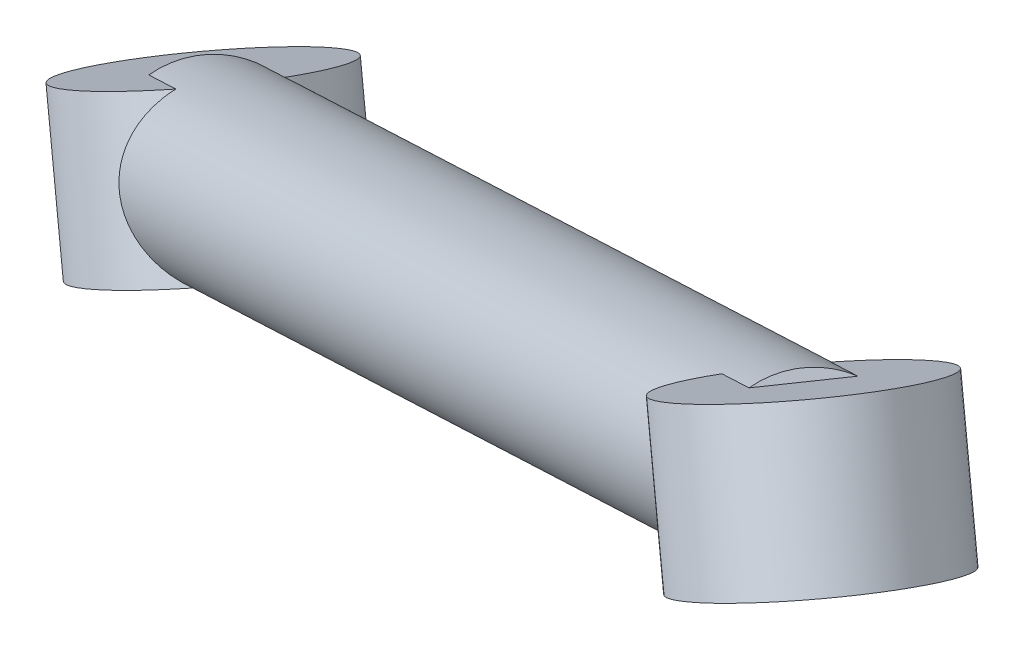
from build123d import *

# Parameters (mm, degrees)
SUSP_FL_PULLROD_PROFILE_R                = 8
SUSP_FL_PULLROD_ROD_END_MOUNT_PROFILE_R  = 11
SUSP_FL_PULLROD_ROD_END_ROCKER_PROFILE_R = 11


with BuildPart() as part:
    # SUSP_FL_pullrod: sweep along a curve in space
    with BuildLine() as susp_fl_pullrod_path:
        Line((-510.46, -91.34, -282.35), (-343.0563, 19.7951, -174.0819))
    # SUSP_FL_pullrod profile (on start of the path) → SUSP_FL_pullrod (sweep)
    with BuildSketch(Plane(origin=(-510.46, -91.34, -282.35), x_dir=(-0.5530888804852541, 0.8331222541041432, 0), z_dir=(0.73343010732889, 0.48690577520692124, 0.47434485739141324))):
        Circle(SUSP_FL_PULLROD_PROFILE_R)
    sweep(path=susp_fl_pullrod_path.line)

    # SUSP_FL_pullrod_rod_end_mount: sweep along a curve in space
    with BuildLine() as susp_fl_pullrod_rod_end_mount_path:
        Line((-513.260832, -85.2266119, -284.294692), (-507.659168, -97.4533881, -280.405308))
    # SUSP_FL_pullrod_rod_end_mount profile (on start of the path) → SUSP_FL_pullrod_rod_end_mount (sweep)
    with BuildSketch(Plane(origin=(-513.260832, -85.2266119, -284.294692), x_dir=(-0.9091288863966713, -0.4165149071991883, 0), z_dir=(0.4001188533527077, -0.8733411488700952, 0.27781314022554215))):
        Circle(SUSP_FL_PULLROD_ROD_END_MOUNT_PROFILE_R)
    sweep(path=susp_fl_pullrod_rod_end_mount_path.line)

    # SUSP_FL_pullrod_rod_end_rocker: sweep along a curve in space
    with BuildLine() as susp_fl_pullrod_rod_end_rocker_path:
        Line((-345.857132, 25.9084881, -176.026592), (-340.255468, 13.6817119, -172.137208))
    # SUSP_FL_pullrod_rod_end_rocker profile (on start of the path) → SUSP_FL_pullrod_rod_end_rocker (sweep)
    with BuildSketch(Plane(origin=(-345.857132, 25.9084881, -176.026592), x_dir=(-0.9091288863966681, -0.41651490719919537, 0), z_dir=(0.40011885335271413, -0.8733411488700913, 0.2778131402255451))):
        Circle(SUSP_FL_PULLROD_ROD_END_ROCKER_PROFILE_R)
    sweep(path=susp_fl_pullrod_rod_end_rocker_path.line)


solid = part.part
